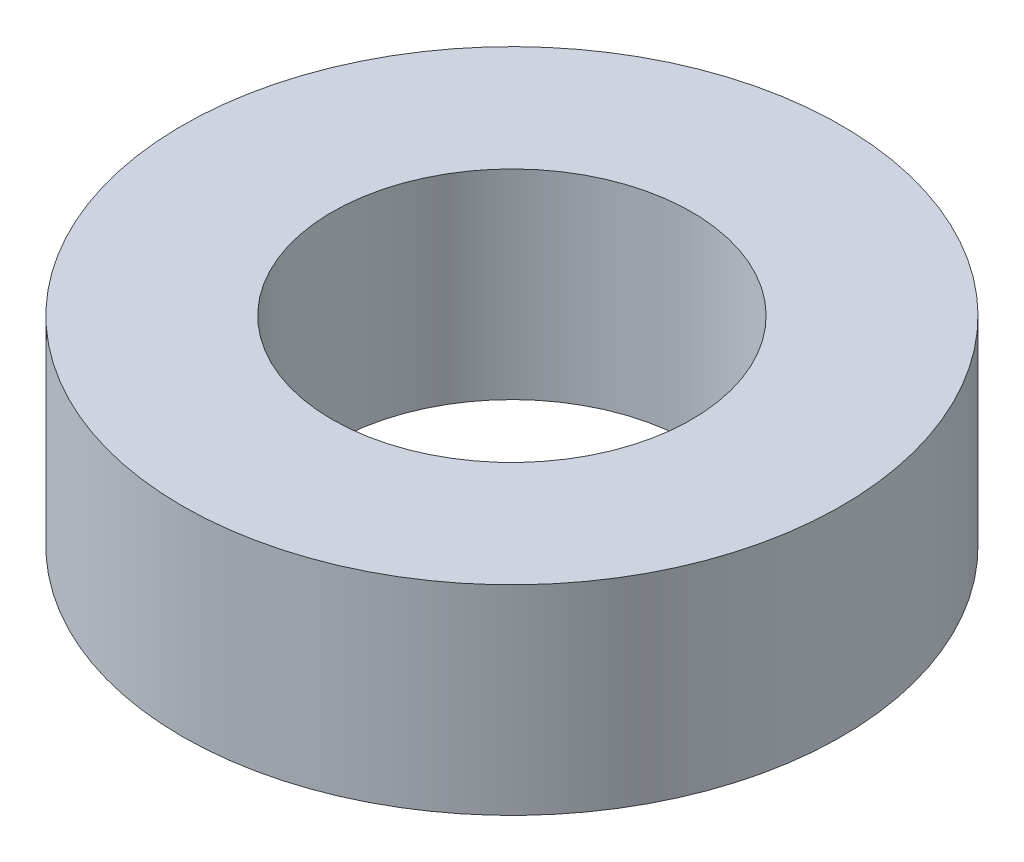
from build123d import *

# Parameters (mm, degrees)
SKETCH1_R           = 3.3
SKETCH1_R_2         = 1.8
BOSS_EXTRUDE1_DEPTH = 2


with BuildPart() as part:
    # Sketch1 → Boss-Extrude1 (new body)
    with BuildSketch(Plane(origin=(0, 0, 0), x_dir=(1, 0, 0), z_dir=(0, 1, 0))):
        with Locations(Location((0, 0, 0), (0, 0, 270))):
            Circle(SKETCH1_R)
        with Locations(Location((0, 0, 0), (0, 0, 270))):
            Circle(SKETCH1_R_2, mode=Mode.SUBTRACT)
    extrude(amount=BOSS_EXTRUDE1_DEPTH)


solid = part.part
